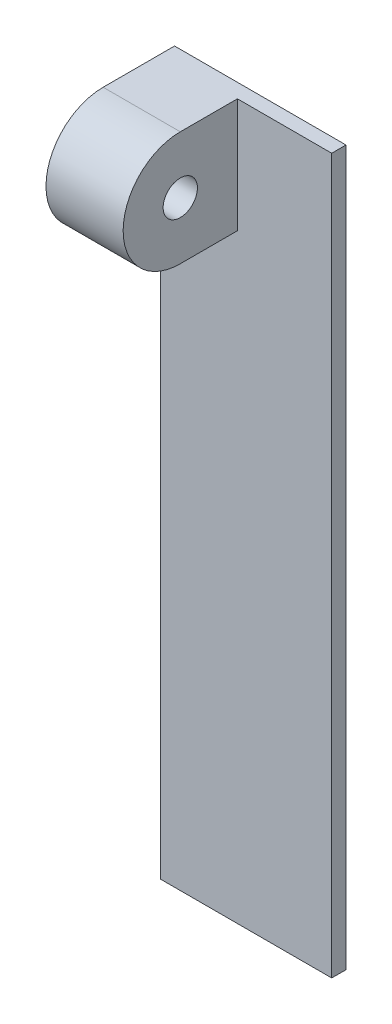
from build123d import *

# Parameters (mm, degrees)
SKETCH1_W           = 60
SKETCH1_H           = 250
BOSS_EXTRUDE1_DEPTH = 5
BOSS_EXTRUDE4_DEPTH = 27
SKETCH7_R           = 6
CUT_EXTRUDE2_DEPTH  = 137.890467163


with BuildPart() as part:
    # Sketch1 → Boss-Extrude1 (new body)
    with BuildSketch(Plane.XY):
        Rectangle(SKETCH1_W, SKETCH1_H)
    extrude(amount=BOSS_EXTRUDE1_DEPTH)

    # Sketch6 → Boss-Extrude4 (add)
    with BuildSketch(Plane.ZY.offset(30)):
        with BuildLine():
            Line((5, 125), (5, 85))
            Line((5, 85), (25, 85))
            ThreePointArc((25, 85), (45, 105), (25, 125))
            Line((25, 125), (5, 125))
        make_face()
    extrude(amount=-BOSS_EXTRUDE4_DEPTH)

    # Sketch7 → Cut-Extrude2 (cut, through all)
    with BuildSketch(Plane(origin=(-3, 0, 0), x_dir=(0, 0, -1), z_dir=(1, 0, 0))):
        with Locations((-25, 105)):
            Circle(SKETCH7_R)
    extrude(amount=-CUT_EXTRUDE2_DEPTH, mode=Mode.SUBTRACT)


solid = part.part
